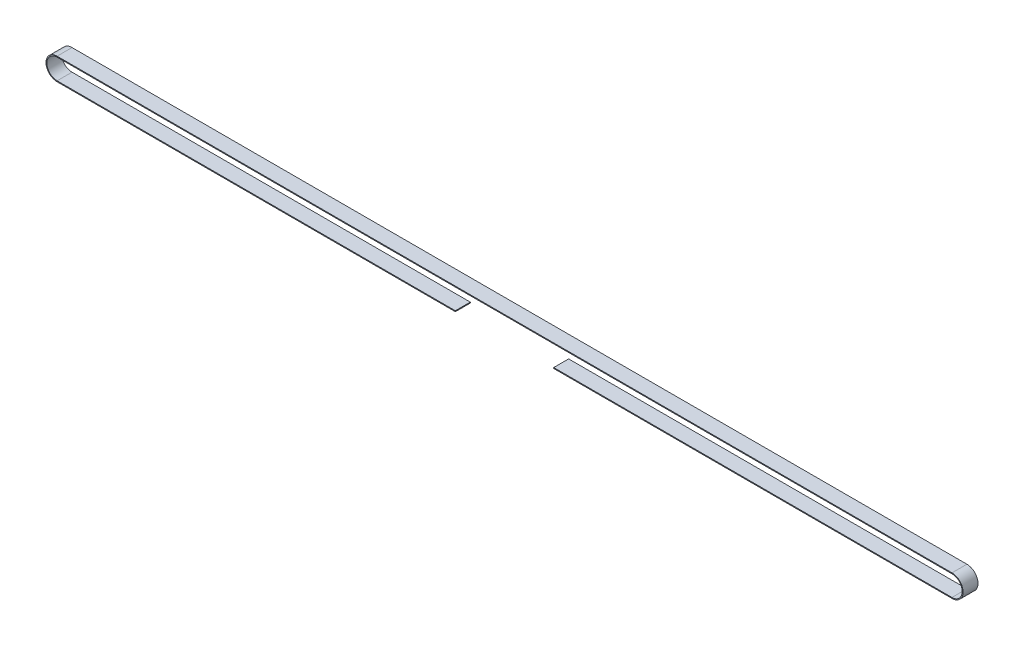
from build123d import *

# Parameters (mm, degrees)
SKETCH2_W               = 8.5
SKETCH2_H               = 0.5
CUT_EXTRUDE1_DEPTH      = 262.181067078
CUT_EXTRUDE1_DEPTH_BACK = 262.181067078
SKETCH3_W               = 56
SKETCH3_H               = 40


with BuildPart() as part:
    # Sweep1: sweep along a path in Sketch1
    with BuildLine(Plane.XY) as sweep1_path:
        Line((-254.75, 5.82), (254.75, 5.82))
        ThreePointArc((254.75, 5.82), (260.57, 0), (254.75, -5.82))
        Line((254.75, -5.82), (-254.75, -5.82))
        ThreePointArc((-254.75, -5.82), (-260.57, 0), (-254.75, 5.82))
    # Sketch2 → Sweep1 (sweep)
    with BuildSketch(Plane(origin=(0, 0, 0), x_dir=(0, 0, -1), z_dir=(1, 0, 0))):
        with Locations((0, 6.07)):
            Rectangle(SKETCH2_W, SKETCH2_H)
    sweep(path=sweep1_path.line)

    # Sketch3 → Cut-Extrude1 (cut, two sides: drawn at the far end of the back side and taken through both)
    with BuildSketch(Plane.XY.offset(-CUT_EXTRUDE1_DEPTH_BACK)):
        with Locations((0, -20)):
            Rectangle(SKETCH3_W, SKETCH3_H)
    extrude(amount=CUT_EXTRUDE1_DEPTH + CUT_EXTRUDE1_DEPTH_BACK, mode=Mode.SUBTRACT)


solid = part.part
